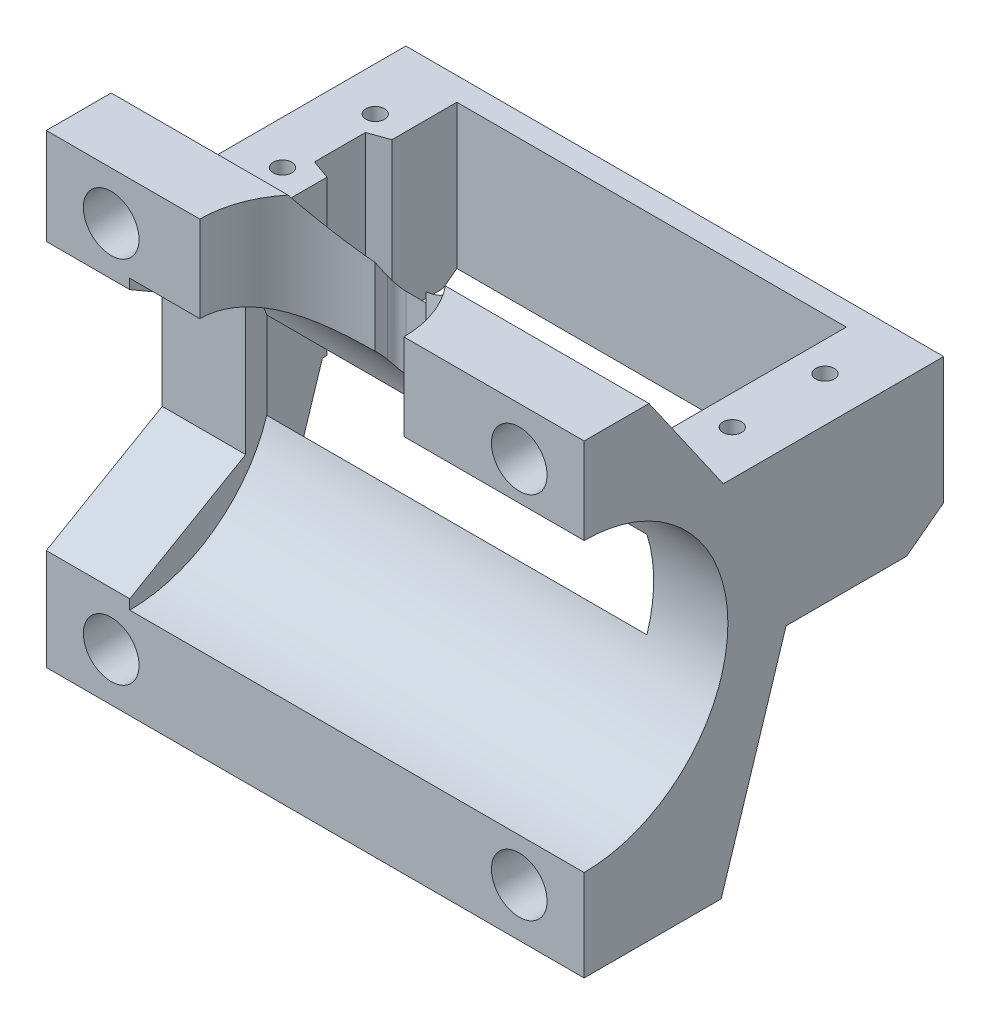
from build123d import *

# Parameters (mm, degrees)
SKETCH1_W               = 58
SKETCH1_H               = 38.77382393
SKETCH1_W_2             = 42
SKETCH1_H_2             = 21.5
BOSS_EXTRUDE2_DEPTH     = 38.65
CUT_EXTRUDE3_DEPTH      = 71.201780604
BOSS_EXTRUDE3_REACH     = 72.202
CUT_EXTRUDE5_DEPTH      = 71.201780604
SKETCH10_W              = 5.5
SKETCH10_H              = 7
CUT_EXTRUDE6_DEPTH      = 17
FILLET1_R               = 1
CUT_EXTRUDE7_DEPTH      = 50.043755974
CUT_EXTRUDE7_DEPTH_BACK = 20
SKETCH11_R              = 15.5
SKETCH12_R              = 3
CUT_EXTRUDE8_DEPTH      = 20
SKETCH13_R              = 4
CUT_EXTRUDE9_DEPTH      = 20
SKETCH15_R              = 1
CUT_EXTRUDE10_DEPTH     = 10
CUT_EXTRUDE11_DEPTH     = 55.764153522


with BuildPart() as part:
    # Sketch1 → Boss-Extrude2 (new body)
    with BuildSketch(Plane(origin=(0, -30, 0), x_dir=(1, 0, 0), z_dir=(0, 1, 0))):
        with Locations((0, -6.386911965)):
            Rectangle(SKETCH1_W, SKETCH1_H)
        with Locations((0, -0.25)):
            Rectangle(SKETCH1_W_2, SKETCH1_H_2, mode=Mode.SUBTRACT)
    extrude(amount=BOSS_EXTRUDE2_DEPTH)

    # Sketch6 → Cut-Extrude3 (cut, through all)
    with BuildSketch(Plane(origin=(29, 0, 0), x_dir=(0, 0, -1), z_dir=(1, 0, 0))):
        Polygon((-11, -30), (-4, -8), (9, -8), (13, -5), (13, -30), align=None)
    extrude(amount=-CUT_EXTRUDE3_DEPTH, mode=Mode.SUBTRACT)

    # Boss-Extrude3: up to this face of the body (flat: up to its plane)
    boss_extrude3_end = Plane(part.part.faces().sort_by_distance((29, -6.820520007, 10.403923083))[0])
    # Sketch9 → Boss-Extrude3 (add, up to the picked face)
    with BuildSketch(Plane.ZY.offset(29), mode=Mode.PRIVATE) as boss_extrude3_sk1:
        Polygon((10.77382393, 8.65), (18.77382393, 20.15), (25.77382393, 20.15), (25.77382393, 8.65), align=None)
    boss_extrude3_tool1 = split(extrude(boss_extrude3_sk1.sketch, amount=-BOSS_EXTRUDE3_REACH, mode=Mode.PRIVATE), bisect_by=boss_extrude3_end, keep=Keep.BOTH, mode=Mode.PRIVATE)
    add(boss_extrude3_tool1.solids().sort_by(Axis((-29, 13.70303, 20.0314), (1, 0, 0)))[0])

    # Sketch8 → Cut-Extrude5 (cut, through all)
    with BuildSketch(Plane.ZY.offset(29)):
        Polygon((25.77382393, 9.78375673), (13.27382393, 2.566878365), (13.27382393, -11.866878365), (25.77382393, -19.08375673), (38.27382393, -11.866878365), (38.27382393, 2.566878365), align=None)
    extrude(amount=-CUT_EXTRUDE5_DEPTH, mode=Mode.SUBTRACT)

    # Sketch10 → Cut-Extrude6 (cut)
    with BuildSketch(Plane(origin=(0, 20.15, 0), x_dir=(1, 0, 0), z_dir=(0, 1, 0))):
        with BuildLine():
            Line((-4.2, -12.77382393), (-4.2, -15.123119728))
            ThreePointArc((-4.2, -15.123119728), (-1.45, -14.77382393), (1.3, -15.123119728))
            Line((1.3, -15.123119728), (1.3, -12.77382393))
            Line((1.3, -12.77382393), (-4.2, -12.77382393))
        make_face()
        with BuildLine():
            Line((1.3, -18.77382393), (1.3, -25.77382393))
            Line((1.3, -25.77382393), (9.55, -25.77382393))
            ThreePointArc((9.55, -25.77382393), (8.90224843, -22.054825081), (7.035281374, -18.77382393))
            Line((7.035281374, -18.77382393), (1.3, -18.77382393))
        make_face()
        with BuildLine():
            Line((1.3, -15.123119728), (1.3, -18.77382393))
            Line((1.3, -18.77382393), (7.035281374, -18.77382393))
            ThreePointArc((7.035281374, -18.77382393), (4.456758602, -16.4942656), (1.3, -15.123119728))
        make_face()
        with BuildLine():
            Line((-4.2, -15.123119728), (-4.2, -18.77382393))
            Line((-4.2, -18.77382393), (1.3, -18.77382393))
            Line((1.3, -18.77382393), (1.3, -15.123119728))
            ThreePointArc((1.3, -15.123119728), (-1.45, -14.77382393), (-4.2, -15.123119728))
        make_face()
        with BuildLine():
            Line((-12.45, -25.77382393), (-4.2, -25.77382393))
            Line((-4.2, -25.77382393), (-4.2, -18.77382393))
            Line((-4.2, -18.77382393), (-9.935281374, -18.77382393))
            ThreePointArc((-9.935281374, -18.77382393), (-11.80224843, -22.054825081), (-12.45, -25.77382393))
        make_face()
        with Locations((-1.45, -22.27382393)):
            Rectangle(SKETCH10_W, SKETCH10_H)
        with BuildLine():
            Line((-9.935281374, -18.77382393), (-4.2, -18.77382393))
            Line((-4.2, -18.77382393), (-4.2, -15.123119728))
            ThreePointArc((-4.2, -15.123119728), (-7.356758602, -16.4942656), (-9.935281374, -18.77382393))
        make_face()
    extrude(amount=-CUT_EXTRUDE6_DEPTH, mode=Mode.SUBTRACT)

    # Fillet1
    fillet1_edges = [part.edges().sort_by_distance(p)[0] for p in [
        (1.3, 7.3375, 12.77382393),
        (-4.2, 7.3375, 12.77382393),
    ]]
    fillet(fillet1_edges, radius=FILLET1_R)

    # Sketch11 → Cut-Extrude7 (cut, two sides: drawn at the far end of the back side and taken through both)
    with BuildSketch(Plane(origin=(0, 0, 0), x_dir=(0, 0, -1), z_dir=(1, 0, 0)).offset(-CUT_EXTRUDE7_DEPTH_BACK)):
        with Locations((-25.77382393, -4.65)):
            Circle(SKETCH11_R)
    extrude(amount=CUT_EXTRUDE7_DEPTH + CUT_EXTRUDE7_DEPTH_BACK, mode=Mode.SUBTRACT)

    # Sketch12 → Cut-Extrude8 (cut)
    with BuildSketch(Plane.XY.offset(25.77382393)):
        with Locations((-22, 14.966878365)):
            Circle(SKETCH12_R)
        with Locations((22, 14.966878365)):
            Circle(SKETCH12_R)
        with Locations(Location((22, -24.816878365, 0), (0, 0, 250.528779366))):
            Circle(SKETCH12_R)
        with Locations(Location((-22, -24.816878365, 0), (0, 0, 70.528779366))):
            Circle(SKETCH12_R)
    extrude(amount=-CUT_EXTRUDE8_DEPTH, mode=Mode.SUBTRACT)

    # Sketch13 → Cut-Extrude9 (cut)
    with BuildSketch(Plane.XY):
        with Locations(Location((22, 14.966878365, 0), (0, 0, 270))):
            Circle(SKETCH13_R)
        with Locations(Location((-22, 14.966878365, 0), (0, 0, 270))):
            Circle(SKETCH13_R)
        with Locations(Location((22, -24.816878365, 0), (0, 0, 255.522487814))):
            Circle(SKETCH13_R)
        with Locations(Location((-22, -24.816878365, 0), (0, 0, 75.522487814))):
            Circle(SKETCH13_R)
    extrude(amount=CUT_EXTRUDE9_DEPTH, mode=Mode.SUBTRACT)

    # Sketch15 → Cut-Extrude10 (cut)
    with BuildSketch(Plane(origin=(0, 8.65, 0), x_dir=(1, 0, 0), z_dir=(0, 1, 0))):
        with Locations(Location((-24.3, 5, 0), (0, 0, 270))):
            Circle(SKETCH15_R)
        with Locations(Location((-24.3, -5, 0), (0, 0, 90))):
            Circle(SKETCH15_R)
        with Locations(Location((24.2, 5, 0), (0, 0, 270))):
            Circle(SKETCH15_R)
        with Locations(Location((24.2, -5, 0), (0, 0, 90))):
            Circle(SKETCH15_R)
    extrude(amount=-CUT_EXTRUDE10_DEPTH, mode=Mode.SUBTRACT)

    # Sketch17 → Cut-Extrude11 (cut, through all)
    with BuildSketch(Plane(origin=(0, 8.65, 0), x_dir=(1, 0, 0), z_dir=(0, 1, 0))):
        Polygon((-21, -3.5), (-21, 3.5), (-23.1, 2.75), (-23.1, -2.75), align=None)
    extrude(amount=-CUT_EXTRUDE11_DEPTH, mode=Mode.SUBTRACT)


solid = part.part
